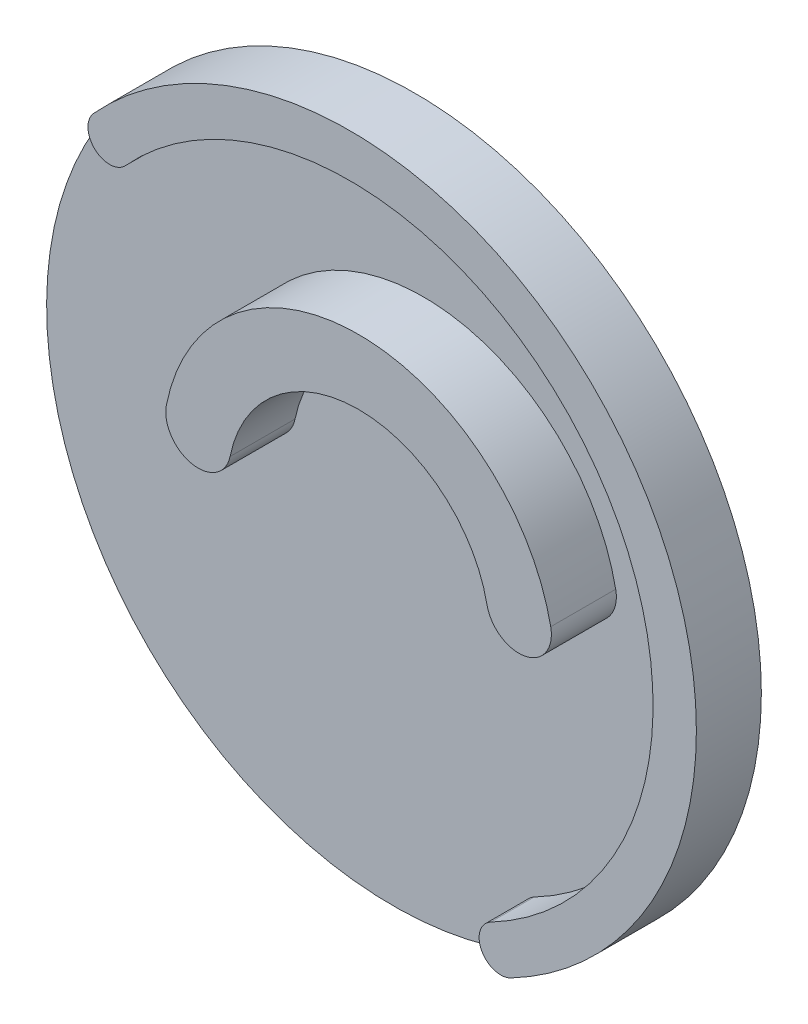
from build123d import *

# Parameters (mm, degrees)
SKETCH1_R           = 16
BOSS_EXTRUDE1_DEPTH = 1
BOSS_EXTRUDE2_DEPTH = 3
BOSS_EXTRUDE3_START = 2
BOSS_EXTRUDE3_DEPTH = 2


with BuildPart() as part:
    # Sketch1 → Boss-Extrude1 (new body)
    with BuildSketch(Plane.XY):
        with Locations((24.677925359, 4)):
            Circle(SKETCH1_R)
    extrude(amount=-BOSS_EXTRUDE1_DEPTH)

    # Sketch1<3> → Boss-Extrude2 (add)
    with BuildSketch(Plane.XY):
        with BuildLine():
            ThreePointArc((34.952555431, 5.797906435), (26.080180575, 13.052706951), (17.207805718, 5.797906435))
            ThreePointArc((17.207805718, 5.797906435), (18.380018924, 4.02988036), (20.148044999, 5.202093565))
            ThreePointArc((20.148044999, 5.202093565), (26.080180575, 10.052706951), (32.01231615, 5.202093565))
            ThreePointArc((32.01231615, 5.202093565), (33.780342225, 4.02988036), (34.952555431, 5.797906435))
        make_face()
    extrude(amount=BOSS_EXTRUDE2_DEPTH)

    # Sketch2 → Boss-Extrude3 (add)
    with BuildSketch(Plane.XY.offset(BOSS_EXTRUDE3_START)):
        with BuildLine():
            ThreePointArc((32.111206734, -10.168497733), (37.340396009, 13.78068694), (12.847014077, 14.771700806))
            ThreePointArc((12.847014077, 14.771700806), (12.913214732, 13.35903755), (14.325877987, 13.425238205))
            ThreePointArc((14.325877987, 13.425238205), (35.757587178, 12.558101073), (31.182046562, -8.397435516))
            ThreePointArc((31.182046562, -8.397435516), (30.761095539, -9.74754671), (32.111206734, -10.168497733))
        make_face()
    extrude(amount=-BOSS_EXTRUDE3_DEPTH)


solid = part.part
